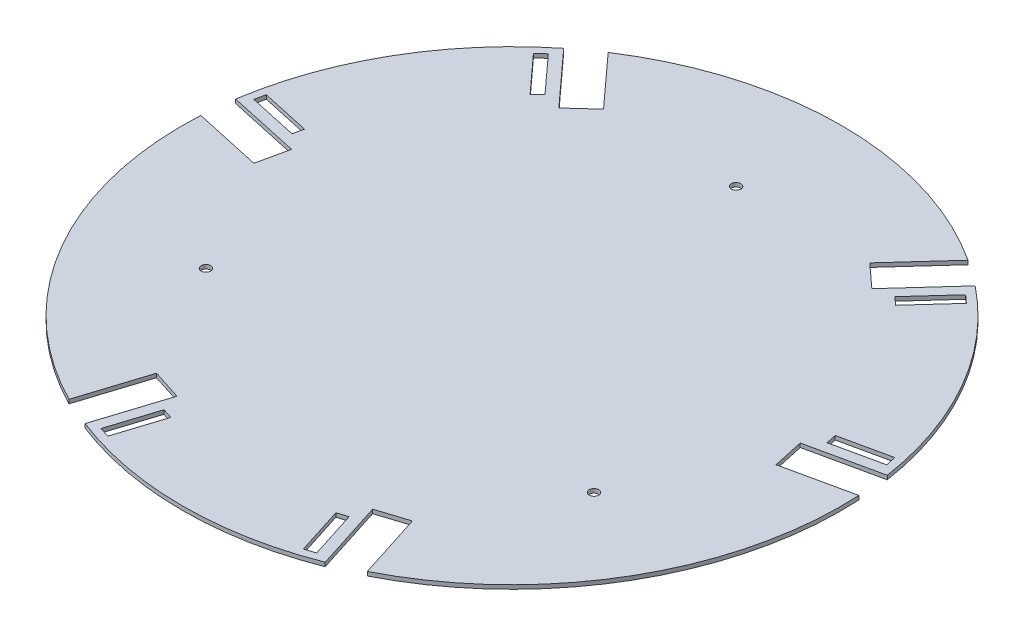
from build123d import *

# Parameters (mm, degrees)
SKETCH2_R           = 125
BOSS_EXTRUDE1_DEPTH = 1.5
SKETCH3_W           = 3
SKETCH3_H           = 19
CUT_EXTRUDE1_DEPTH  = 177.783059143
SKETCH4_R           = 1.8
CUT_EXTRUDE2_DEPTH  = 177.783059143
CUT_EXTRUDE5_DEPTH  = 177.783059143
CIRPATTERN2_COUNT   = 3


with BuildPart() as part:
    # Sketch2 → Boss-Extrude1 (new body)
    with BuildSketch(Plane(origin=(0, 0, 0), x_dir=(1, 0, 0), z_dir=(0, 1, 0))):
        with Locations(Location((0, 0, 0), (0, 0, 270))):
            Circle(SKETCH2_R)
    extrude(amount=BOSS_EXTRUDE1_DEPTH)

    # Sketch3 → Cut-Extrude1 (cut, through all)
    with BuildSketch(Plane(origin=(0, 1.5, 0), x_dir=(1, 0, 0), z_dir=(0, 1, 0))):
        with Locations((-268.691654721, -368.173324402)):
            Rectangle(SKETCH3_W, SKETCH3_H)
        Polygon((31.312, -98.125219266), (35.122688127, -96.909219266), (40.898688127, -115.009987868), (37.088, -116.225987868), align=None)
        Polygon((-37.088, -116.225987868), (-31.312, -98.125219266), (-35.122688127, -96.909219266), (-40.898688127, -115.009987868), align=None)
        Polygon((-82.110658074, 90.23214411), (-69.322932636, 76.179597076), (-66.364501682, 78.8717498), (-79.15222712, 92.924296834), align=None)
        Polygon((-100.634932636, 21.94562219), (-101.487189809, 18.037469466), (-120.050915246, 22.085691035), (-119.198658074, 25.993843759), align=None)
        Polygon((119.198658074, 25.993843759), (100.634932636, 21.94562219), (101.487189809, 18.037469466), (120.050915246, 22.085691035), align=None)
        Polygon((69.322932636, 76.179597076), (66.364501682, 78.8717498), (79.15222712, 92.924296834), (82.110658074, 90.23214411), align=None)
    extrude(amount=-CUT_EXTRUDE1_DEPTH, mode=Mode.SUBTRACT)

    # Sketch4 → Cut-Extrude2 (cut, through all)
    with BuildSketch(Plane(origin=(0, 1.5, 0), x_dir=(1, 0, 0), z_dir=(0, 1, 0))):
        with Locations(Location((0, 85, 0), (0, 0, 270))):
            Circle(SKETCH4_R)
        with Locations(Location((73.612159322, -42.5, 0), (0, 0, 270))):
            Circle(SKETCH4_R)
        with Locations(Location((-73.612159322, -42.5, 0), (0, 0, 270))):
            Circle(SKETCH4_R)
    extrude(amount=-CUT_EXTRUDE2_DEPTH, mode=Mode.SUBTRACT)

    # Sketch6 → Cut-Extrude5 (cut, through all)
    with BuildSketch(Plane(origin=(0, 1.5, 0), x_dir=(1, 0, 0), z_dir=(0, 1, 0))):
        Polygon((-55.992533724, -149.153029157), (-67.424598105, -145.505029157), (-48.541440634, -86.329187076), (-37.109376254, -89.977187076), align=None)
        Polygon((67.424598105, -145.505029157), (48.541440634, -86.329187076), (37.109376254, -89.977187076), (55.992533724, -149.153029157), align=None)
    cut_extrude5 = extrude(amount=-CUT_EXTRUDE5_DEPTH, mode=Mode.SUBTRACT)

    # CirPattern2: Cut-Extrude5 ×3 about axis
    cirpattern2_axis = Axis((0, 0, 0), (0, 1, 0))
    for i in range(1, CIRPATTERN2_COUNT):
        add(cut_extrude5.rotate(cirpattern2_axis, i * 360 / CIRPATTERN2_COUNT), mode=Mode.SUBTRACT)


solid = part.part
